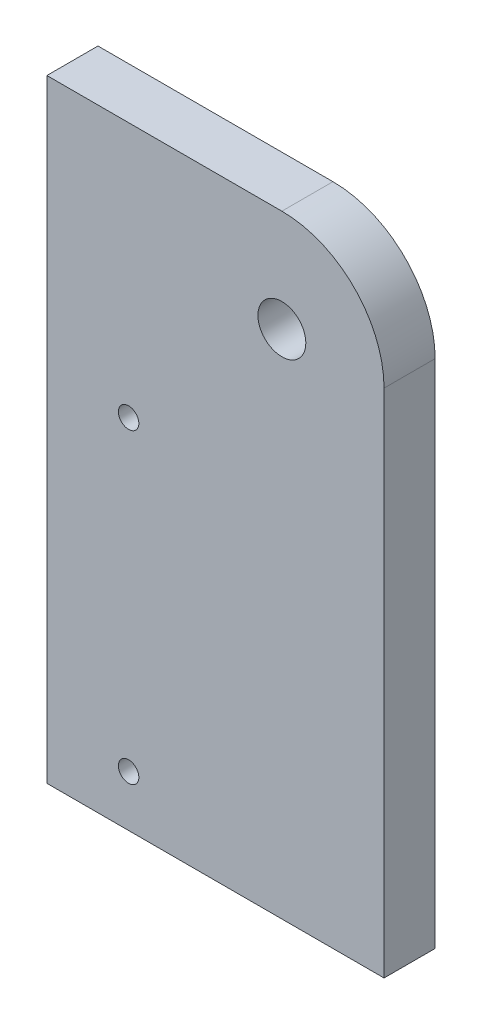
from build123d import *

# Parameters (mm, degrees)
CROQUIS1_R              = 2.34375
CROQUIS1_R_2            = 1
SALIENTE_EXTRUIR4_DEPTH = 5


with BuildPart() as part:
    # Croquis1 → Saliente-Extruir4 (new body)
    with BuildSketch(Plane.XY):
        with BuildLine():
            Line((0, 60), (0, 0))
            Line((0, 0), (33, 0))
            Line((33, 0), (33, 50))
            ThreePointArc((33, 50), (30.071067812, 57.071067812), (23, 60))
            Line((23, 60), (0, 60))
        make_face()
        with Locations((23, 50)):
            Circle(CROQUIS1_R, mode=Mode.SUBTRACT)
        with Locations((8, 5)):
            Circle(CROQUIS1_R_2, mode=Mode.SUBTRACT)
        with Locations((8, 35)):
            Circle(CROQUIS1_R_2, mode=Mode.SUBTRACT)
    extrude(amount=SALIENTE_EXTRUIR4_DEPTH)


solid = part.part
